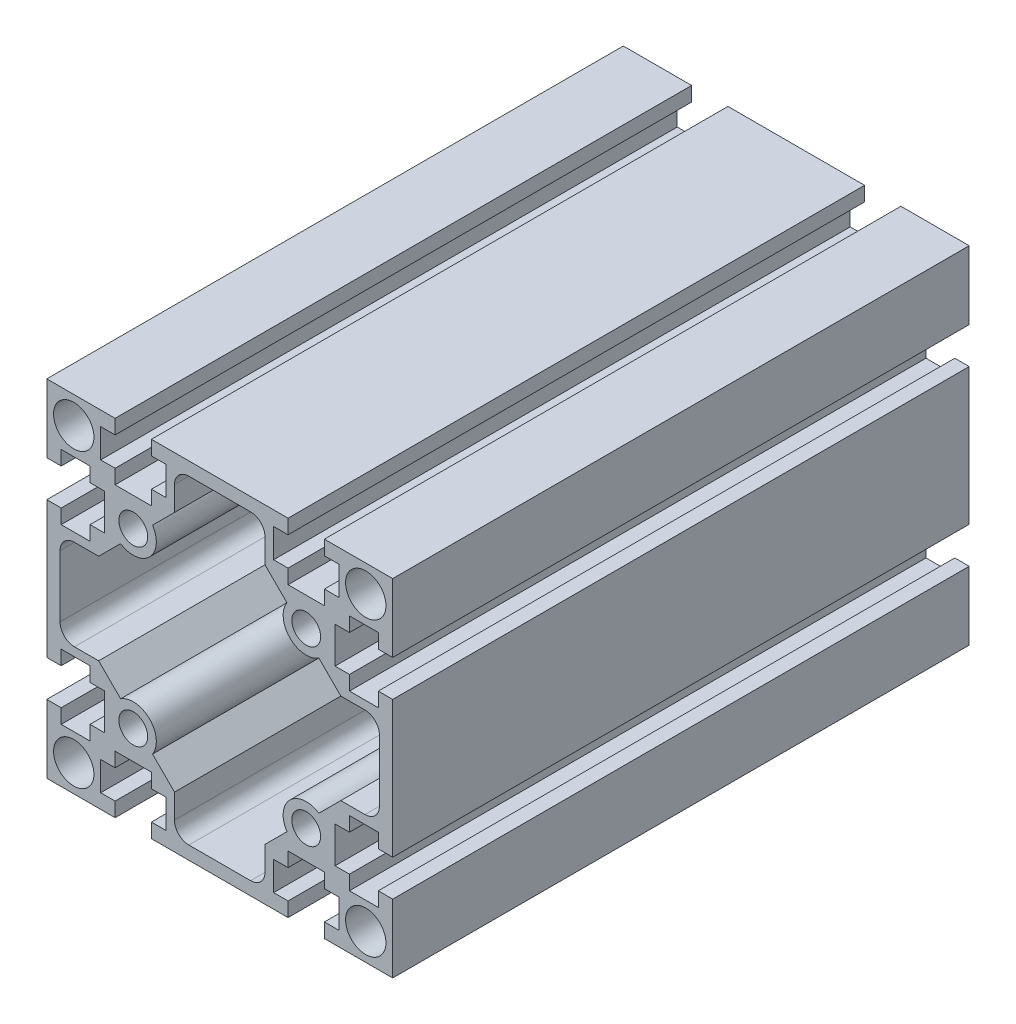
from build123d import *

# Parameters (mm, degrees)
SKETCH_1_R      = 2.5
SKETCH_1_R_2    = 3.5
EXTRUDE_1_DEPTH = 100


with BuildPart() as part:
    # 草图1 → 凸台-拉伸1 (new body)
    with BuildSketch(Plane.XY):
        Polygon((-29.877197952, 10.487377279), (-29.877197952, -1.362622721), (-29.877197952, -13.212622721), (-27.377197952, -13.212622721), (-27.377197952, -10.712622721), (-22.377197952, -10.712622721), (-22.377197952, -13.212622721), (-19.877197952, -13.212622721), (-19.877197952, -19.512622721), (-22.377197952, -19.512622721), (-22.377197952, -22.012622721), (-27.377197952, -22.012622721), (-27.377197952, -19.512622721), (-29.877197952, -19.512622721), (-29.877197952, -31.362622721), (-18.027197952, -31.362622721), (-18.027197952, -28.862622721), (-20.527197952, -28.862622721), (-20.527197952, -23.862622721), (-18.027197952, -23.862622721), (-18.027197952, -21.362622721), (-11.727197952, -21.362622721), (-11.727197952, -23.862622721), (-9.227197952, -23.862622721), (-9.227197952, -28.862622721), (-11.727197952, -28.862622721), (-11.727197952, -31.362622721), (0.122802048, -31.362622721), (11.972802048, -31.362622721), (11.972802048, -28.862622721), (9.472802048, -28.862622721), (9.472802048, -23.862622721), (11.972802048, -23.862622721), (11.972802048, -21.362622721), (18.272802048, -21.362622721), (18.272802048, -23.862622721), (20.772802048, -23.862622721), (20.772802048, -28.862622721), (18.272802048, -28.862622721), (18.272802048, -31.362622721), (30.122802048, -31.362622721), (30.122802048, -19.512622721), (27.622802048, -19.512622721), (27.622802048, -22.012622721), (22.622802048, -22.012622721), (22.622802048, -19.512622721), (20.122802048, -19.512622721), (20.122802048, -13.212622721), (22.622802048, -13.212622721), (22.622802048, -10.712622721), (27.622802048, -10.712622721), (27.622802048, -13.212622721), (30.122802048, -13.212622721), (30.122802048, -1.362622721), (30.122802048, 10.487377279), (27.622802048, 10.487377279), (27.622802048, 7.987377279), (22.622802048, 7.987377279), (22.622802048, 10.487377279), (20.122802048, 10.487377279), (20.122802048, 16.787377279), (22.622802048, 16.787377279), (22.622802048, 19.287377279), (27.622802048, 19.287377279), (27.622802048, 16.787377279), (30.122802048, 16.787377279), (30.122802048, 28.637377279), (18.272802048, 28.637377279), (18.272802048, 26.137377279), (20.772802048, 26.137377279), (20.772802048, 21.137377279), (18.272802048, 21.137377279), (18.272802048, 18.637377279), (11.972802048, 18.637377279), (11.972802048, 21.137377279), (9.472802048, 21.137377279), (9.472802048, 26.137377279), (11.972802048, 26.137377279), (11.972802048, 28.637377279), (0.122802048, 28.637377279), (-11.727197952, 28.637377279), (-11.727197952, 26.137377279), (-9.227197952, 26.137377279), (-9.227197952, 21.137377279), (-11.727197952, 21.137377279), (-11.727197952, 18.637377279), (-18.027197952, 18.637377279), (-18.027197952, 21.137377279), (-20.527197952, 21.137377279), (-20.527197952, 26.137377279), (-18.027197952, 26.137377279), (-18.027197952, 28.637377279), (-29.877197952, 28.637377279), (-29.877197952, 16.787377279), (-27.377197952, 16.787377279), (-27.377197952, 19.287377279), (-22.377197952, 19.287377279), (-22.377197952, 16.787377279), (-19.877197952, 16.787377279), (-19.877197952, 10.487377279), (-22.377197952, 10.487377279), (-22.377197952, 7.987377279), (-27.377197952, 7.987377279), (-27.377197952, 10.487377279), align=None)
        with Locations((-14.877197952, 13.637377279)):
            Circle(SKETCH_1_R, mode=Mode.SUBTRACT)
        with Locations((-25.202197952, 23.962377279)):
            Circle(SKETCH_1_R_2, mode=Mode.SUBTRACT)
        with Locations((15.122802048, 13.637377279)):
            Circle(SKETCH_1_R, mode=Mode.SUBTRACT)
        with Locations((25.447802048, 23.962377279)):
            Circle(SKETCH_1_R_2, mode=Mode.SUBTRACT)
        with Locations((-14.877197952, -16.362622721)):
            Circle(SKETCH_1_R, mode=Mode.SUBTRACT)
        with Locations((-25.202197952, -26.687622721)):
            Circle(SKETCH_1_R_2, mode=Mode.SUBTRACT)
        with Locations((15.122802048, -16.362622721)):
            Circle(SKETCH_1_R, mode=Mode.SUBTRACT)
        with Locations((25.447802048, -26.687622721)):
            Circle(SKETCH_1_R_2, mode=Mode.SUBTRACT)
        with BuildLine():
            Line((0.122802048, 26.337377279), (-5.227197952, 26.337377279))
            ThreePointArc((-5.227197952, 26.337377279), (-6.994964905, 25.605144232), (-7.727197952, 23.837377279))
            Line((-7.727197952, 23.837377279), (-7.727197952, 19.637377279))
            Line((-7.727197952, 19.637377279), (-11.532834307, 15.831740924))
            ThreePointArc((-11.532834307, 15.831740924), (-12.048770828, 10.808950154), (-17.071561598, 10.293013634))
            Line((-17.071561598, 10.293013634), (-20.877197952, 6.487377279))
            Line((-20.877197952, 6.487377279), (-25.077197952, 6.487377279))
            ThreePointArc((-25.077197952, 6.487377279), (-26.844964905, 5.755144232), (-27.577197952, 3.987377279))
            Line((-27.577197952, 3.987377279), (-27.577197952, -6.712622721))
            ThreePointArc((-27.577197952, -6.712622721), (-26.844964905, -8.480389674), (-25.077197952, -9.212622721))
            Line((-25.077197952, -9.212622721), (-20.877197952, -9.212622721))
            Line((-20.877197952, -9.212622721), (-17.071561598, -13.018259076))
            ThreePointArc((-17.071561598, -13.018259076), (-12.048770828, -13.534195596), (-11.532834307, -18.556986366))
            Line((-11.532834307, -18.556986366), (-7.727197952, -22.362622721))
            Line((-7.727197952, -22.362622721), (-7.727197952, -26.562622721))
            ThreePointArc((-7.727197952, -26.562622721), (-6.994964905, -28.330389674), (-5.227197952, -29.062622721))
            Line((-5.227197952, -29.062622721), (0.122802048, -29.062622721))
            Line((0.122802048, -29.062622721), (5.472802048, -29.062622721))
            ThreePointArc((5.472802048, -29.062622721), (7.240569001, -28.330389674), (7.972802048, -26.562622721))
            Line((7.972802048, -26.562622721), (7.972802048, -22.362622721))
            Line((7.972802048, -22.362622721), (11.778438402, -18.556986366))
            ThreePointArc((11.778438402, -18.556986366), (12.294374923, -13.534195596), (17.317165693, -13.018259076))
            Line((17.317165693, -13.018259076), (21.122802048, -9.212622721))
            Line((21.122802048, -9.212622721), (25.322802048, -9.212622721))
            ThreePointArc((25.322802048, -9.212622721), (27.090569001, -8.480389674), (27.822802048, -6.712622721))
            Line((27.822802048, -6.712622721), (27.822802048, 3.987377279))
            ThreePointArc((27.822802048, 3.987377279), (27.090569001, 5.755144232), (25.322802048, 6.487377279))
            Line((25.322802048, 6.487377279), (21.122802048, 6.487377279))
            Line((21.122802048, 6.487377279), (17.317165693, 10.293013634))
            ThreePointArc((17.317165693, 10.293013634), (12.294374923, 10.808950154), (11.778438402, 15.831740924))
            Line((11.778438402, 15.831740924), (7.972802048, 19.637377279))
            Line((7.972802048, 19.637377279), (7.972802048, 23.837377279))
            ThreePointArc((7.972802048, 23.837377279), (7.240569001, 25.605144232), (5.472802048, 26.337377279))
            Line((5.472802048, 26.337377279), (0.122802048, 26.337377279))
        make_face(mode=Mode.SUBTRACT)
    extrude(amount=EXTRUDE_1_DEPTH)


solid = part.part
